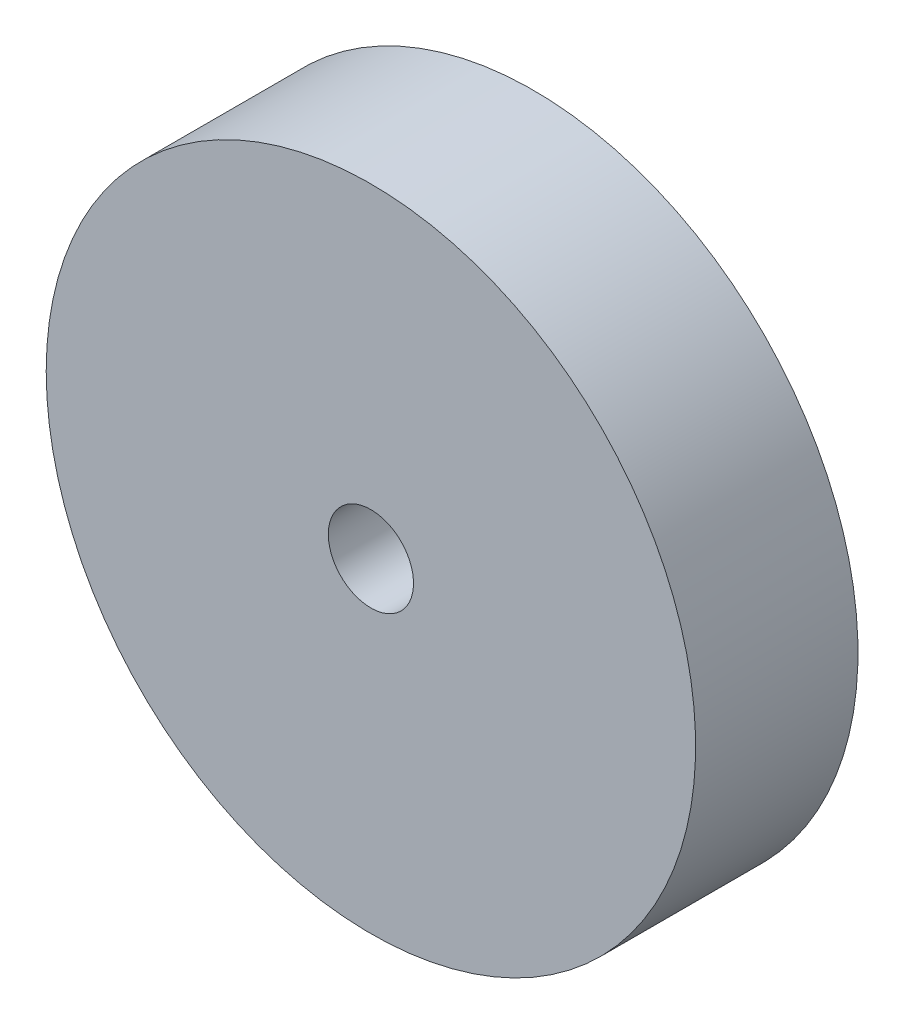
from build123d import *

# Parameters (mm, degrees)
SKETCH2_R           = 38.1
BOSS_EXTRUDE1_DEPTH = 19.05
SKETCH3_R           = 5
CUT_EXTRUDE1_DEPTH  = 58.15


with BuildPart() as part:
    # Sketch2 → Boss-Extrude1 (new body)
    with BuildSketch(Plane.XY):
        with Locations(Location((0, 0, 0), (0, 0, 180))):
            Circle(SKETCH2_R)
    extrude(amount=BOSS_EXTRUDE1_DEPTH)

    # Sketch3 → Cut-Extrude1 (cut, through all)
    with BuildSketch(Plane(origin=(0, 0, 0), x_dir=(-1, 0, 0), z_dir=(0, 0, -1))):
        Circle(SKETCH3_R)
    extrude(amount=-CUT_EXTRUDE1_DEPTH, mode=Mode.SUBTRACT)


solid = part.part
